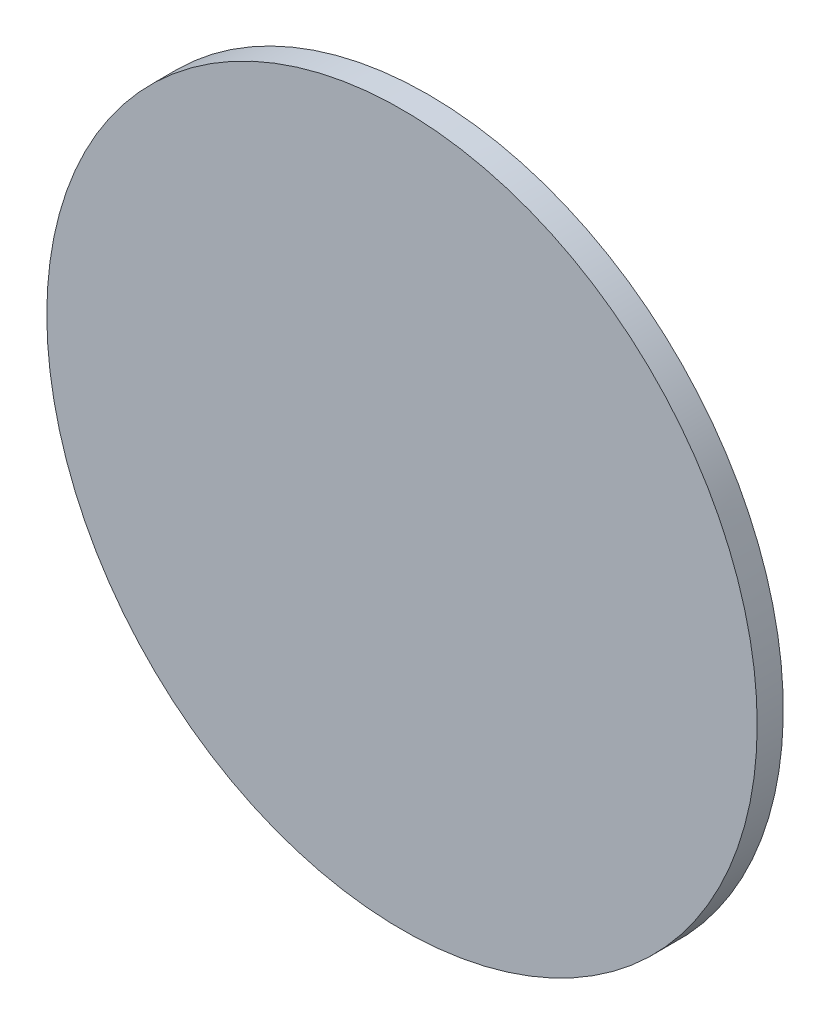
from build123d import *


with BuildPart() as part:
    # 草图2 → 旋转6 (revolve)
    with BuildSketch(Plane(origin=(0, 0, 0), x_dir=(0, 0, -1), z_dir=(1, 0, 0)), mode=Mode.PRIVATE) as revolve_6_sk:
        with BuildLine():
            Line((0, 0), (-0.550094867, 0))
            Line((-0.550094867, 0), (-0.550094867, 5))
            Line((-0.550094867, 5), (-0.183028, 5))
            add(Edge.make_bspline(
                [(0, 0), (-0.001199927, 0.060000008), (-0.003063581, 0.153333415), (-0.008278681, 0.413333153), (-0.012672391, 0.633331638), (-0.016540967, 0.826667472), (-0.017206294, 0.859999273), (-0.017609725, 0.88000271), (-0.017996805, 0.899989886), (-0.018445055, 0.920037752), (-0.018664976, 0.939859146), (-0.019743038, 0.960525622), (-0.01761087, 0.978038361), (-0.025820041, 1.002441483), (-0.010023601, 0.999998683), (0.005942427, 0.997564469), (-0.003289483, 1.021962323), (-0.001846017, 1.039474162), (-0.003756449, 1.060140933), (-0.004770196, 1.079962208), (-0.006022762, 1.100010115), (-0.007210755, 1.119997331), (-0.009625694, 1.160004027), (-0.012820531, 1.213332178), (-0.017238751, 1.28666695), (-0.021638854, 1.360000063), (-0.026054139, 1.43333325), (-0.03045808, 1.506666825), (-0.034873585, 1.579999771), (-0.039275085, 1.653333547), (-0.043691169, 1.726666437), (-0.047291985, 1.786666905), (-0.050099705, 1.8333338), (-0.051703741, 1.859999375), (-0.052908314, 1.880002177), (-0.054099002, 1.899991915), (-0.055343684, 1.920030281), (-0.056392256, 1.939886862), (-0.0581653, 1.960422372), (-0.057242542, 1.978423535), (-0.066373126, 2.005885256), (-0.037980567, 1.99803991), (-0.022182758, 2.001954594), (0.006500554, 1.994133819), (-0.00375424, 2.021579333), (-0.003553994, 2.03957676), (-0.006155774, 2.060113468), (-0.008008927, 2.079969536), (-0.010060502, 2.100008224), (-0.012727944, 2.126660929), (-0.016757891, 2.166669027), (-0.022111624, 2.219999464), (-0.028150013, 2.279999923), (-0.034175091, 2.340000252), (-0.040212879, 2.399999698), (-0.046238129, 2.460000316), (-0.052275869, 2.51999968), (-0.058301133, 2.580000321), (-0.065009669, 2.646666265), (-0.071703616, 2.713333707), (-0.07841176, 2.779999672), (-0.083098891, 2.826667487), (-0.086450858, 2.859999344), (-0.088462874, 2.880002222), (-0.090463663, 2.899991933), (-0.092514456, 2.920029882), (-0.094370529, 2.939888706), (-0.09696141, 2.960415125), (-0.096801841, 2.978450953), (-0.106915881, 3.005782754), (-0.078674616, 2.998423034), (-0.06090004, 3.000524932), (-0.039613251, 2.999477265), (-0.021906602, 3.00156599), (0.006654079, 2.994247393), (-0.004615306, 3.021552877), (-0.005178449, 3.039583825), (-0.008612874, 3.060111599), (-0.01128009, 3.079970013), (-0.014150735, 3.100008119), (-0.017908433, 3.126660979), (-0.02262983, 3.160000983), (-0.029224581, 3.206666515), (-0.037716341, 3.266666371), (-0.047136974, 3.333333788), (-0.056571746, 3.399999582), (-0.065993555, 3.466667147), (-0.07542833, 3.533332864), (-0.085792646, 3.60666714), (-0.095227312, 3.673332865), (-0.105591465, 3.746667165), (-0.114081404, 3.806666207), (-0.120679393, 3.853331703), (-0.124452988, 3.880002251), (-0.12727129, 3.899991912), (-0.130141817, 3.920029872), (-0.132809473, 3.939888832), (-0.136242249, 3.960414519), (-0.136811526, 3.978453086), (-0.14807047, 4.005775265), (-0.119434696, 3.998450431), (-0.101502897, 4.000422536), (-0.08064937, 3.999859414), (-0.060775598, 4.000139788), (-0.039904264, 3.999581457), (-0.022043691, 4.001534395), (0.006922697, 3.994265488), (-0.005523341, 4.021551951), (-0.006821638, 4.039584261), (-0.011116149, 4.060111288), (-0.014605709, 4.079970288), (-0.018313068, 4.100007854), (-0.021959965, 4.119998002), (-0.029290301, 4.160002923), (-0.039041439, 4.21333284), (-0.052471972, 4.286666437), (-0.064667839, 4.353333604), (-0.07809505, 4.426666155), (-0.090292069, 4.493333675), (-0.102498344, 4.559999513), (-0.114693948, 4.626667346), (-0.126902919, 4.693332677), (-0.139098309, 4.760000553), (-0.151306393, 4.826666046), (-0.163501715, 4.893333935), (-0.174488748, 4.953332952), (-0.180587108, 4.986666769), (-0.183028, 5)],
                knots=[0, 0, 0, 0, 0.033615891, 0.052291388, 0.145668868, 0.156874168, 0.160609266, 0.164344365, 0.168079464, 0.171814562, 0.175549664, 0.179284763, 0.183019862, 0.18675496, 0.188622883, 0.190490806, 0.194231896, 0.197972997, 0.201714087, 0.205455188, 0.209196278, 0.212937368, 0.216678469, 0.231642841, 0.242866133, 0.257830504, 0.272794887, 0.284018168, 0.29898255, 0.313946921, 0.325170214, 0.340134585, 0.347616776, 0.351357877, 0.355098967, 0.358840057, 0.362581158, 0.366322248, 0.37006335, 0.37380444, 0.37754553, 0.38128735, 0.385029171, 0.388770991, 0.392524154, 0.396277336, 0.4000305, 0.403783682, 0.407536845, 0.411290027, 0.418796373, 0.430055882, 0.441315409, 0.452574918, 0.463834445, 0.475093954, 0.486353482, 0.49761299, 0.508872518, 0.52388519, 0.535144718, 0.546404226, 0.550157408, 0.553910572, 0.557663754, 0.561416917, 0.565170099, 0.568923263, 0.572676445, 0.576429608, 0.580183565, 0.583937336, 0.587691293, 0.59144525, 0.595199207, 0.598970706, 0.602742232, 0.606513731, 0.610285257, 0.614056756, 0.617828281, 0.625371306, 0.632914305, 0.644228855, 0.659314878, 0.670629428, 0.681943952, 0.697030002, 0.708344526, 0.723430575, 0.734745099, 0.749831149, 0.757374173, 0.761145673, 0.764917198, 0.768688697, 0.772460223, 0.776231722, 0.780003221, 0.783774747, 0.787547002, 0.791319258, 0.795091513, 0.798863955, 0.802636211, 0.806408466, 0.810180722, 0.813977122, 0.817773489, 0.821569889, 0.825366256, 0.829162656, 0.832959023, 0.836755424, 0.851940958, 0.863330125, 0.878515659, 0.889904827, 0.905090361, 0.916479528, 0.927868662, 0.94305423, 0.954443364, 0.965832531, 0.981018065, 0.992407233, 1, 1, 1, 1], degree=3))
        make_face()
    revolve(revolve_6_sk.sketch.rotate(Axis((0, 0, 0), (0, 0, 1)), 90), axis=Axis((0, 0, 0), (0, 0, 1)))


solid = part.part
